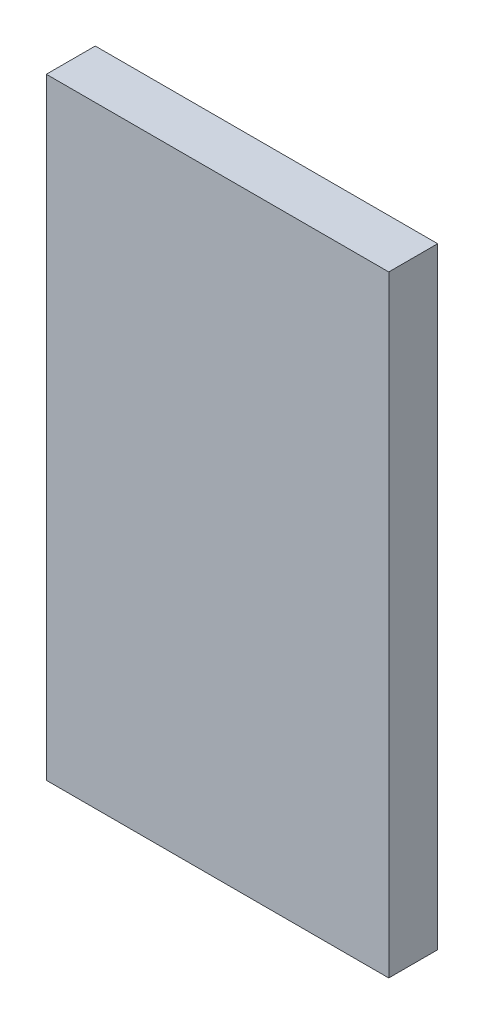
from build123d import *

# Parameters (mm, degrees)
SKETCH2_W           = 140
SKETCH2_H           = 250
BOSS_EXTRUDE1_DEPTH = 20


with BuildPart() as part:
    # Sketch2 → Boss-Extrude1 (new body)
    with BuildSketch(Plane.XY):
        Rectangle(SKETCH2_W, SKETCH2_H)
    extrude(amount=BOSS_EXTRUDE1_DEPTH)


solid = part.part
